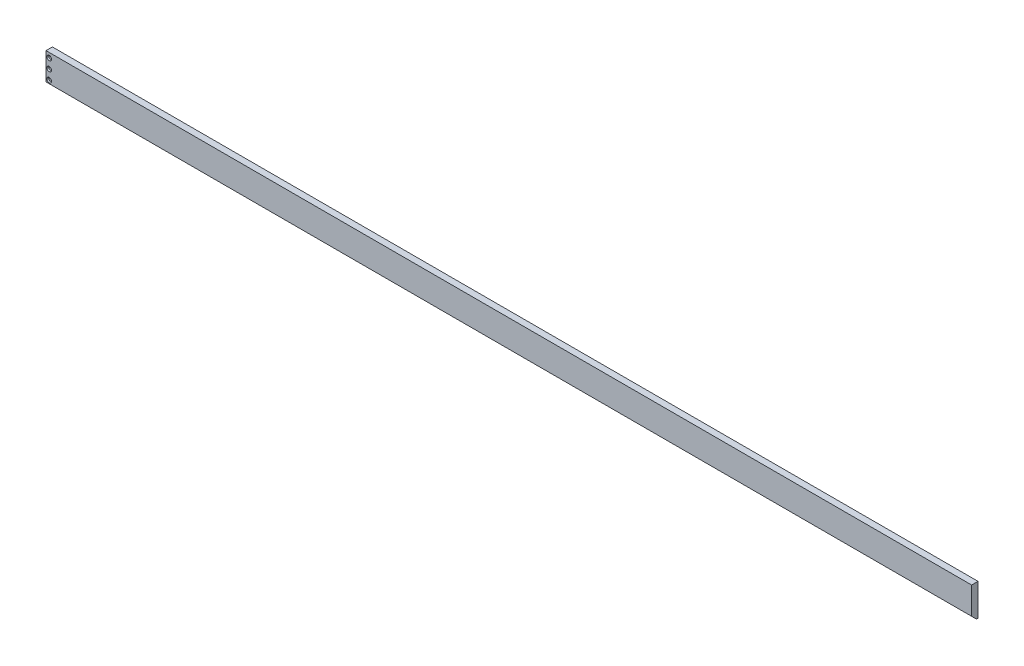
from build123d import *

# Parameters (mm, degrees)
IZIM1_W                     = 2900
IZIM1_H                     = 100
Y_KSEKLIK_EKSTR_ZYON1_DEPTH = 20
PAH1_SIZE                   = 15
IZIM3_R                     = 4.25
KES_EKSTR_ZYON3_DEPTH       = 30
PAH3_SIZE                   = 3


with BuildPart() as part:
    # Çizim1 → Yükseklik-Ekstrüzyon1 (new body)
    with BuildSketch(Plane.XY):
        Rectangle(IZIM1_W, IZIM1_H)
    extrude(amount=Y_KSEKLIK_EKSTR_ZYON1_DEPTH)

    # Pah1
    pah1_edges = [part.edges().sort_by_distance(p)[0] for p in [
        (0, -50, 20),
    ]]
    chamfer(pah1_edges, length=PAH1_SIZE)

    # Çizim3 → Kes-Ekstrüzyon3 (cut)
    with BuildSketch(Plane.XY.offset(20)):
        with Locations((-1440, 35)):
            Circle(IZIM3_R)
        with Locations((-1440, -25)):
            Circle(IZIM3_R)
        with Locations((-1440, 5)):
            Circle(IZIM3_R)
    extrude(amount=-KES_EKSTR_ZYON3_DEPTH, mode=Mode.SUBTRACT)

    # Pah3
    pah3_edges = [part.edges().sort_by_distance(p)[0] for p in [
        (-1444.25, 35, 20),
        (-1444.25, -25, 20),
        (-1444.25, 5, 20),
    ]]
    chamfer(pah3_edges, length=PAH3_SIZE)


solid = part.part
